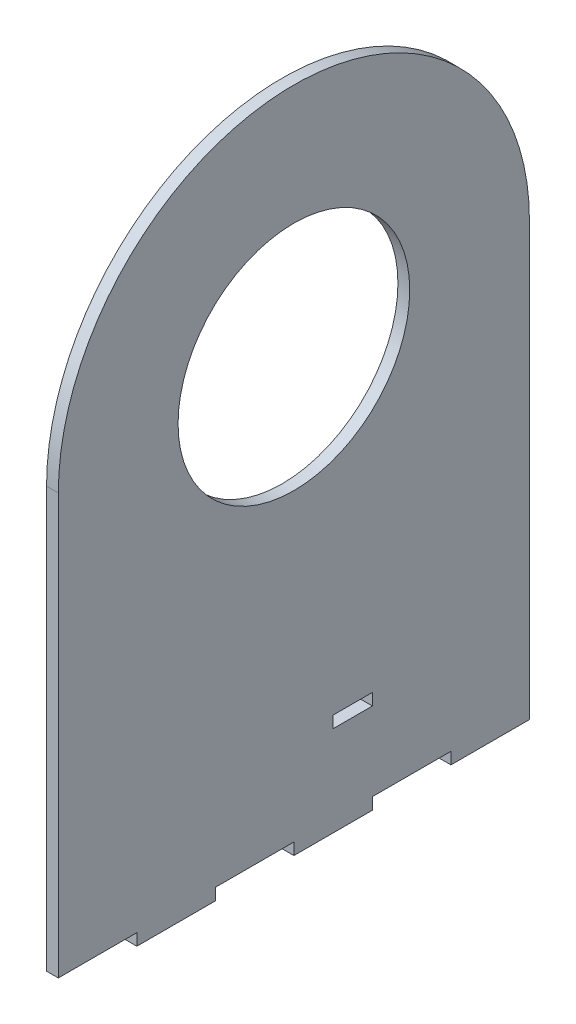
from build123d import *

# Parameters (mm, degrees)
CROQUIS1_R              = 29.5
CROQUIS1_W              = 10
CROQUIS1_H              = 3
SALIENTE_EXTRUIR1_DEPTH = 3


with BuildPart() as part:
    # Croquis1 → Saliente-Extruir1 (new body)
    with BuildSketch(Plane(origin=(0, 0, 0), x_dir=(0, 0, -1), z_dir=(1, 0, 0))):
        with BuildLine():
            Line((-60, -82), (-40, -82))
            Line((-40, -82), (-40, -85))
            Line((-40, -85), (-20, -85))
            Line((-20, -85), (-20, -82))
            Line((-20, -82), (0, -82))
            Line((0, -82), (0, -85))
            Line((0, -85), (20, -85))
            Line((20, -85), (20, -82))
            Line((20, -82), (40, -82))
            Line((40, -82), (40, -85))
            Line((40, -85), (60, -85))
            Line((60, -85), (60, 25))
            ThreePointArc((60, 25), (0, 85), (-60, 25))
            Line((-60, 25), (-60, -82))
        make_face()
        with Locations((0, 25)):
            Circle(CROQUIS1_R, mode=Mode.SUBTRACT)
        with Locations((15, -60.5)):
            Rectangle(CROQUIS1_W, CROQUIS1_H, mode=Mode.SUBTRACT)
    extrude(amount=SALIENTE_EXTRUIR1_DEPTH)


solid = part.part
